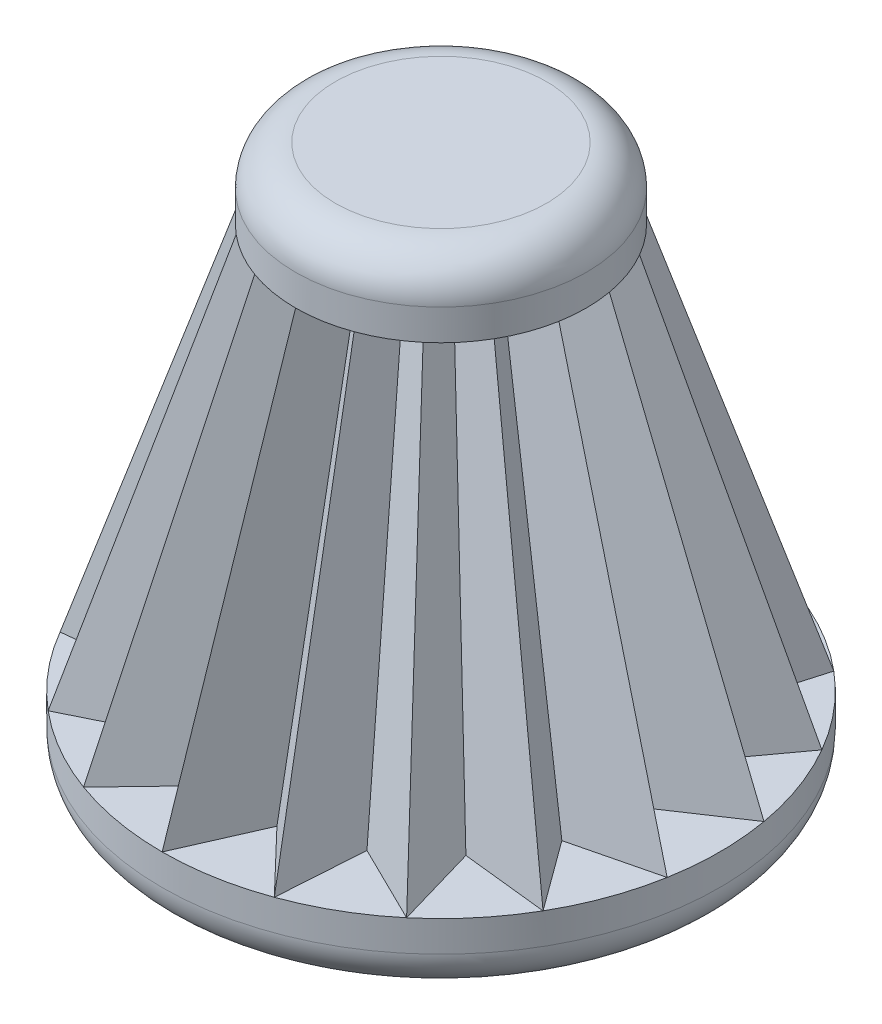
from build123d import *

# Parameters (mm, degrees)
SHELL2_T            = -1.01
SKETCH3_R           = 36.5
BOSS_EXTRUDE3_DEPTH = 17.75
SKETCH5_R           = 70
BOSS_EXTRUDE4_DEPTH = 17.75
FILLET3_R           = 10
SKETCH6_R           = 15
CUT_EXTRUDE1_DEPTH  = 57.75


with BuildPart() as part:
    # Sketch2 → Loft1 section 0
    with BuildSketch(Plane(origin=(0, 101.5, 0), x_dir=(1, 0, 0), z_dir=(0, 1, 0))):
        with BuildLine():
            Line((-31.609927238, -18.25), (-24.877067597, -9.054512121))
            Line((-24.877067597, -9.054512121), (-35.945482985, -6.338158485))
            Line((-35.945482985, -6.338158485), (-26.473622381, 0))
            Line((-26.473622381, 0), (-35.945482985, 6.338158485))
            Line((-35.945482985, 6.338158485), (-24.877067597, 9.054512121))
            Line((-24.877067597, 9.054512121), (-31.609927238, 18.25))
            Line((-31.609927238, 18.25), (-20.279971314, 17.01691645))
            Line((-20.279971314, 17.01691645), (-23.461747754, 27.960622174))
            Line((-23.461747754, 27.960622174), (-13.236811191, 22.926829512))
            Line((-13.236811191, 22.926829512), (-12.483735231, 34.298780659))
            Line((-12.483735231, 34.298780659), (-4.597096283, 26.071428571))
            Line((-4.597096283, 26.071428571), (0, 36.5))
            Line((0, 36.5), (4.597096283, 26.071428571))
            Line((4.597096283, 26.071428571), (12.483735231, 34.298780659))
            Line((12.483735231, 34.298780659), (13.236811191, 22.926829512))
            Line((13.236811191, 22.926829512), (23.461747754, 27.960622174))
            Line((23.461747754, 27.960622174), (20.279971314, 17.01691645))
            Line((20.279971314, 17.01691645), (31.609927238, 18.25))
            Line((31.609927238, 18.25), (24.877067597, 9.054512121))
            Line((24.877067597, 9.054512121), (35.945482985, 6.338158485))
            Line((35.945482985, 6.338158485), (26.473622381, 0))
            Line((26.473622381, 0), (35.945482985, -6.338158485))
            Line((35.945482985, -6.338158485), (24.877067597, -9.054512121))
            Line((24.877067597, -9.054512121), (31.609927238, -18.25))
            Line((31.609927238, -18.25), (20.279971314, -17.01691645))
            Line((20.279971314, -17.01691645), (23.461747754, -27.960622174))
            Line((23.461747754, -27.960622174), (13.236811191, -22.926829512))
            Line((13.236811191, -22.926829512), (12.483735231, -34.298780659))
            Line((12.483735231, -34.298780659), (4.597096283, -26.071428571))
            Line((4.597096283, -26.071428571), (0, -36.5))
            Line((0, -36.5), (-4.597096283, -26.071428571))
            Line((-4.597096283, -26.071428571), (-12.483735231, -34.298780659))
            Line((-12.483735231, -34.298780659), (-13.236811191, -22.926829512))
            Line((-13.236811191, -22.926829512), (-23.461747754, -27.960622174))
            Line((-23.461747754, -27.960622174), (-20.279971314, -17.01691645))
            Line((-20.279971314, -17.01691645), (-31.609927238, -18.25))
        make_face()
    # Sketch1 → Loft1 section 1
    with BuildSketch(Plane(origin=(0, 0, 0), x_dir=(1, 0, 0), z_dir=(0, 1, 0))):
        with BuildLine():
            Line((0, 70), (-8.816349035, 50))
            Line((-8.816349035, 50), (-23.941410033, 65.778483455))
            Line((-23.941410033, 65.778483455), (-25.385665297, 43.969262079))
            Line((-25.385665297, 43.969262079), (-44.995132678, 53.623111018))
            Line((-44.995132678, 53.623111018), (-38.893095672, 32.635182233))
            Line((-38.893095672, 32.635182233), (-60.621778265, 35))
            Line((-60.621778265, 35), (-47.709444707, 17.364817767))
            Line((-47.709444707, 17.364817767), (-68.936542711, 12.155372437))
            Line((-68.936542711, 12.155372437), (-50.771330594, 0))
            Line((-50.771330594, 0), (-68.936542711, -12.155372437))
            Line((-68.936542711, -12.155372437), (-47.709444707, -17.364817767))
            Line((-47.709444707, -17.364817767), (-60.621778265, -35))
            Line((-60.621778265, -35), (-38.893095672, -32.635182233))
            Line((-38.893095672, -32.635182233), (-44.995132678, -53.623111018))
            Line((-44.995132678, -53.623111018), (-25.385665297, -43.969262079))
            Line((-25.385665297, -43.969262079), (-23.941410033, -65.778483455))
            Line((-23.941410033, -65.778483455), (-8.816349035, -50))
            Line((-8.816349035, -50), (0, -70))
            Line((0, -70), (8.816349035, -50))
            Line((8.816349035, -50), (23.941410033, -65.778483455))
            Line((23.941410033, -65.778483455), (25.385665297, -43.969262079))
            Line((25.385665297, -43.969262079), (44.995132678, -53.623111018))
            Line((44.995132678, -53.623111018), (38.893095672, -32.635182233))
            Line((38.893095672, -32.635182233), (60.621778265, -35))
            Line((60.621778265, -35), (47.709444707, -17.364817767))
            Line((47.709444707, -17.364817767), (68.936542711, -12.155372437))
            Line((68.936542711, -12.155372437), (50.771330594, 0))
            Line((50.771330594, 0), (68.936542711, 12.155372437))
            Line((68.936542711, 12.155372437), (47.709444707, 17.364817767))
            Line((47.709444707, 17.364817767), (60.621778265, 35))
            Line((60.621778265, 35), (38.893095672, 32.635182233))
            Line((38.893095672, 32.635182233), (44.995132678, 53.623111018))
            Line((44.995132678, 53.623111018), (25.385665297, 43.969262079))
            Line((25.385665297, 43.969262079), (23.941410033, 65.778483455))
            Line((23.941410033, 65.778483455), (8.816349035, 50))
            Line((8.816349035, 50), (0, 70))
        make_face()
    loft()

    # Shell2
    shell2_openings = [part.faces().sort_by_distance(p)[0] for p in [
        (0, 0, 0),
        (0, 101.5, 0),
    ]]
    offset(amount=SHELL2_T, openings=shell2_openings, kind=Kind.INTERSECTION)

    # Sketch3 → Boss-Extrude3 (add)
    with BuildSketch(Plane(origin=(0, 101.5, 0), x_dir=(1, 0, 0), z_dir=(0, 1, 0))):
        with Locations(Location((0, 0, 0), (0, 0, 270))):
            Circle(SKETCH3_R)
    extrude(amount=BOSS_EXTRUDE3_DEPTH)

    # Sketch5 → Boss-Extrude4 (add)
    with BuildSketch(Plane(origin=(0, 0, 0), x_dir=(1, 0, 0), z_dir=(0, 1, 0))):
        with Locations(Location((0, 0, 0), (0, 0, 270))):
            Circle(SKETCH5_R)
    extrude(amount=-BOSS_EXTRUDE4_DEPTH)

    # Fillet3
    fillet3_edges = [part.edges().sort_by_distance(p)[0] for p in [
        (0, 119.25, -36.5),
        (0, -17.75, -70),
    ]]
    fillet(fillet3_edges, radius=FILLET3_R)

    # Sketch6 → Cut-Extrude1 (cut)
    with BuildSketch(Plane.XZ.offset(17.75)):
        with Locations(Location((0, 0, 0), (0, 0, 270))):
            Circle(SKETCH6_R)
    extrude(amount=-CUT_EXTRUDE1_DEPTH, mode=Mode.SUBTRACT)


solid = part.part
